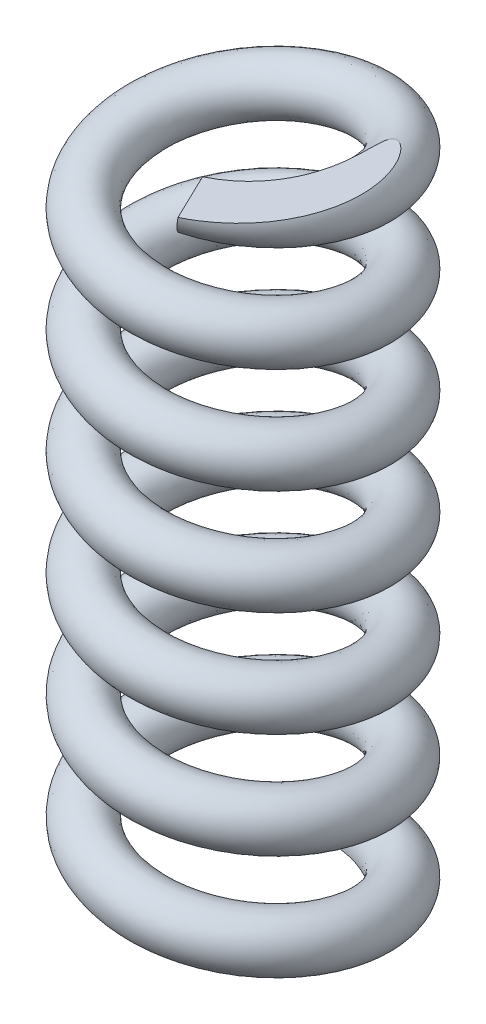
from build123d import *

# Parameters (mm, degrees)
SWEEP_5_PITCH            = 7
SWEEP_5_HEIGHT           = 45
SWEEP_5_RADIUS           = 7.5
SWEEP_5_START_ANGLE      = -180
SWEEP_5_PROFILE_R        = 1.75
CUT_EXTRUDE_2_DEPTH      = 49.527438473
CUT_EXTRUDE_2_DEPTH_BACK = 49.527438473
SKETCH_89_W              = 69.978044934
SKETCH_89_H              = 62.275198725
SKETCH_89_W_2            = 46.999315539
SKETCH_89_H_2            = 45


with BuildPart() as part:
    # По траектории5: sweep along a helix
    with BuildLine() as sweep_5_path:
        add(Helix(SWEEP_5_PITCH, SWEEP_5_HEIGHT, SWEEP_5_RADIUS, center=(0, 0, 0), direction=(0, 1, 0), lefthand=True, mode=Mode.PRIVATE).rotate(Axis((0, 0, 0), (0, 1, 0)), SWEEP_5_START_ANGLE))
    # По траектории5 profile (on start of the path) → По траектории5 (sweep)
    with BuildSketch(Plane(origin=(0, 0, -7.5), x_dir=(-0.14693239016529505, 0.9891465375364328, 0), z_dir=(0.9891465375364328, 0.14693239016529505, 5.355045365340524e-13))):
        Circle(SWEEP_5_PROFILE_R)
    sweep(path=sweep_5_path.line, is_frenet=True)

    # Эскиз89 → Вырез-Вытянуть2 (cut, two sides: drawn at the far end of the back side and taken through both)
    with BuildSketch(Plane.XY.offset(-CUT_EXTRUDE_2_DEPTH_BACK)):
        with Locations((-2.820856745, 23.891235002)):
            Rectangle(SKETCH_89_W, SKETCH_89_H)
        with Locations((-5.338677221, 22.5)):
            Rectangle(SKETCH_89_W_2, SKETCH_89_H_2, mode=Mode.SUBTRACT)
    extrude(amount=CUT_EXTRUDE_2_DEPTH + CUT_EXTRUDE_2_DEPTH_BACK, mode=Mode.SUBTRACT)


solid = part.part
